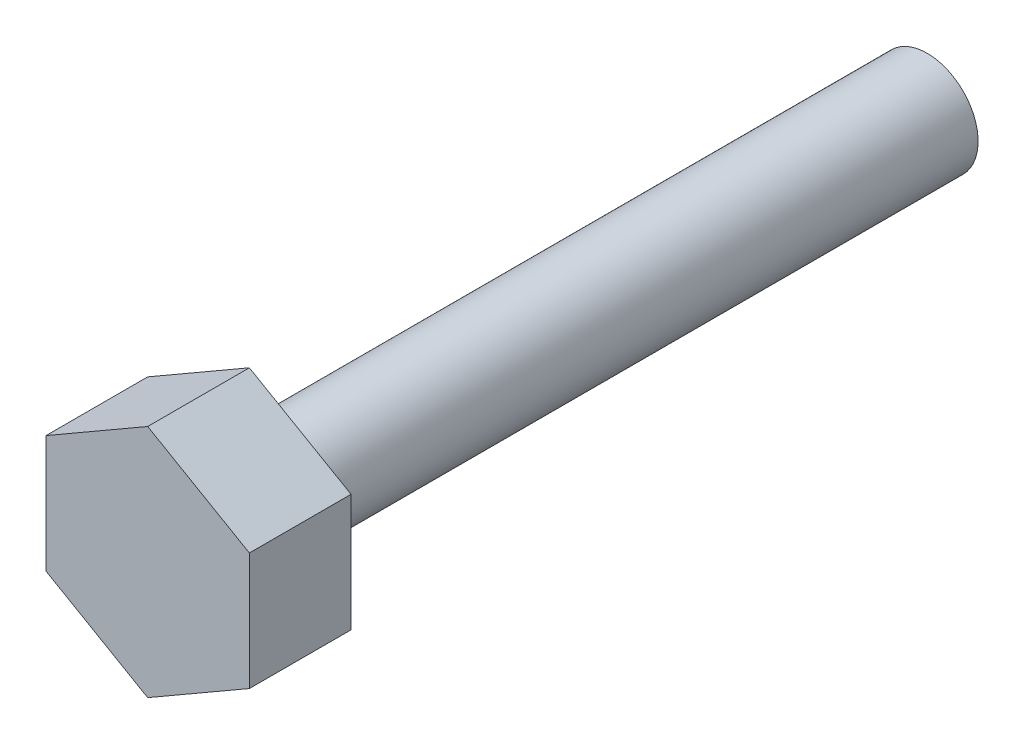
from build123d import *

# Parameters (mm, degrees)
BOSS_EXTRUDE2_DEPTH = 3
SKETCH5_R           = 3
BOSS_EXTRUDE3_DEPTH = 40


with BuildPart() as part:
    # Sketch4 → Boss-Extrude2 (new, symmetric)
    with BuildSketch(Plane.XY):
        Polygon((0, 6.92820323), (-6, 3.464101615), (-6, -3.464101615), (0, -6.92820323), (6, -3.464101615), (6, 3.464101615), align=None)
    extrude(amount=BOSS_EXTRUDE2_DEPTH, both=True)

    # Sketch5 → Boss-Extrude3 (add)
    with BuildSketch(Plane(origin=(0, 0, -3), x_dir=(-1, 0, 0), z_dir=(0, 0, -1))):
        Circle(SKETCH5_R)
    extrude(amount=BOSS_EXTRUDE3_DEPTH)


solid = part.part
